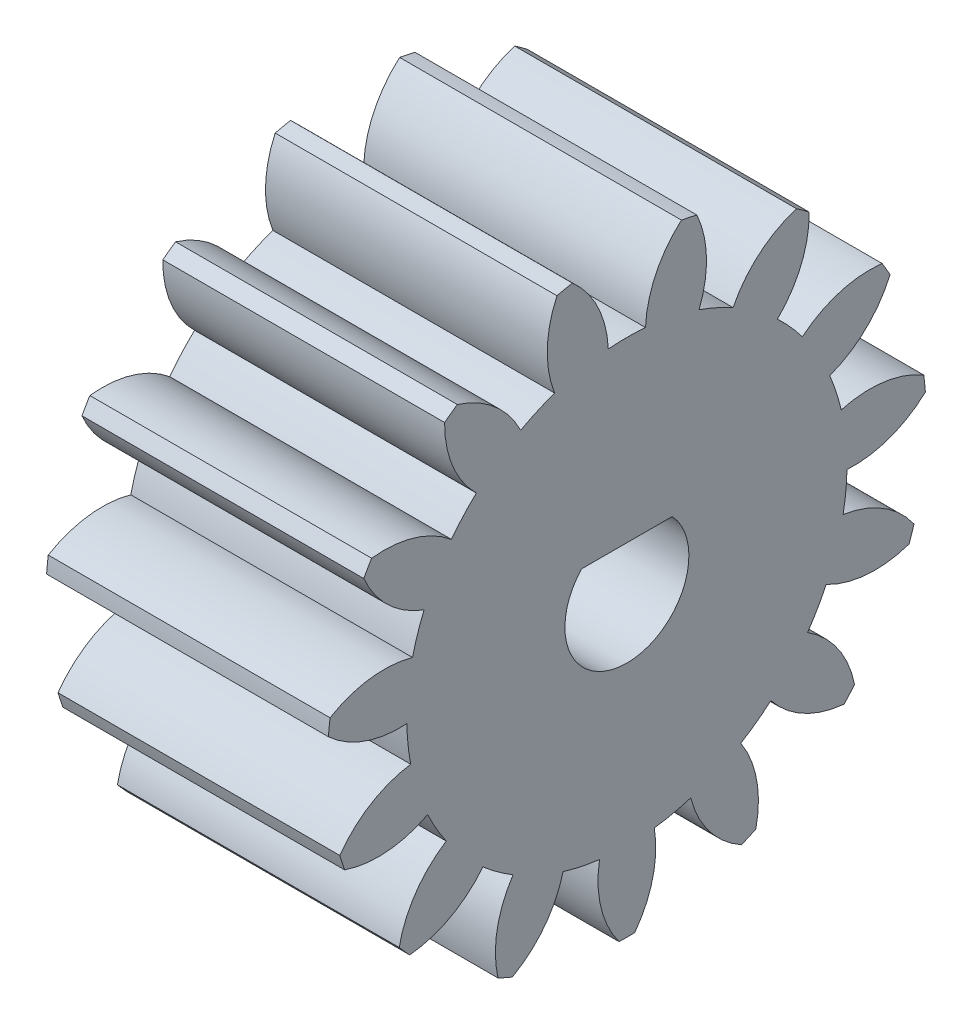
from build123d import *

# Parameters (mm, degrees)
BASPROSKE_W         = 10
BASPROSKE_H         = 10.625
TOOTHCUT_DEPTH      = 19.049411348
TEETHCUTS_COUNT     = 15
TEETHCUTS_ANGLE     = 336
BORSKE_R            = 2
BORE_DEPTH          = 50.0000508
SKETCH1_R           = 2.2
CUT_EXTRUDE2_DEPTH  = 10
BOSS_EXTRUDE1_DEPTH = 10


with BuildPart() as part:
    # BasProSke → Base-Revolve (revolve)
    with BuildSketch(Plane(origin=(0, 0, 0), x_dir=(1, 0, 0), z_dir=(0, 1, 0)), mode=Mode.PRIVATE) as base_revolve_sk:
        with Locations((5, 5.3125)):
            Rectangle(BASPROSKE_W, BASPROSKE_H)
    revolve(base_revolve_sk.sketch.rotate(Axis((-10, 0, 0), (1, 0, 0)), 180), axis=Axis((-10, 0, 0), (1, 0, 0)))

    # TooCutSke → ToothCut (cut, through all)
    with BuildSketch(Plane(origin=(0, 0, 0), x_dir=(0, 0, -1), z_dir=(1, 0, 0))):
        with BuildLine():
            ThreePointArc((0.660831632, 7.78349753), (0, 7.8115), (-0.660831632, 7.78349753))
            ThreePointArc((-0.660831632, 7.78349753), (-1.031814994, 9.260718016), (-1.959681305, 10.46855622))
            ThreePointArc((-1.959681305, 10.46855622), (0, 10.6504), (1.959681305, 10.46855622))
            ThreePointArc((1.959681305, 10.46855622), (1.031814994, 9.260718016), (0.660831632, 7.78349753))
        make_face()
    toothcut = extrude(amount=TOOTHCUT_DEPTH, mode=Mode.SUBTRACT)

    # TeethCuts: ToothCut ×15 about axis
    teethcuts_axis = Axis((-10, 0, 0), (1, 0, 0))
    for i in range(1, TEETHCUTS_COUNT):
        add(toothcut.rotate(teethcuts_axis, i * TEETHCUTS_ANGLE / (TEETHCUTS_COUNT - 1)), mode=Mode.SUBTRACT)

    # BorSke → Bore (cut, symmetric)
    with BuildSketch(Plane(origin=(0, 0, 0), x_dir=(0, 0, -1), z_dir=(1, 0, 0))):
        with Locations(Location((0, 0, 0), (0, 0, 180))):
            Circle(BORSKE_R)
    extrude(amount=BORE_DEPTH, both=True, mode=Mode.SUBTRACT)

    # Sketch1 → Cut-Extrude2 (cut)
    with BuildSketch(Plane(origin=(10, 0, 0), x_dir=(0, 0, -1), z_dir=(1, 0, 0))):
        Circle(SKETCH1_R)
    extrude(amount=-CUT_EXTRUDE2_DEPTH, mode=Mode.SUBTRACT)

    # Sketch4 → Boss-Extrude1 (add)
    with BuildSketch(Plane(origin=(10, 0, 0), x_dir=(0, 0, -1), z_dir=(1, 0, 0))):
        with BuildLine():
            ThreePointArc((1.609347694, 1.5), (0, 2.2), (-1.609347694, 1.5))
            Line((-1.609347694, 1.5), (1.609347694, 1.5))
        make_face()
    extrude(amount=-BOSS_EXTRUDE1_DEPTH)


solid = part.part
